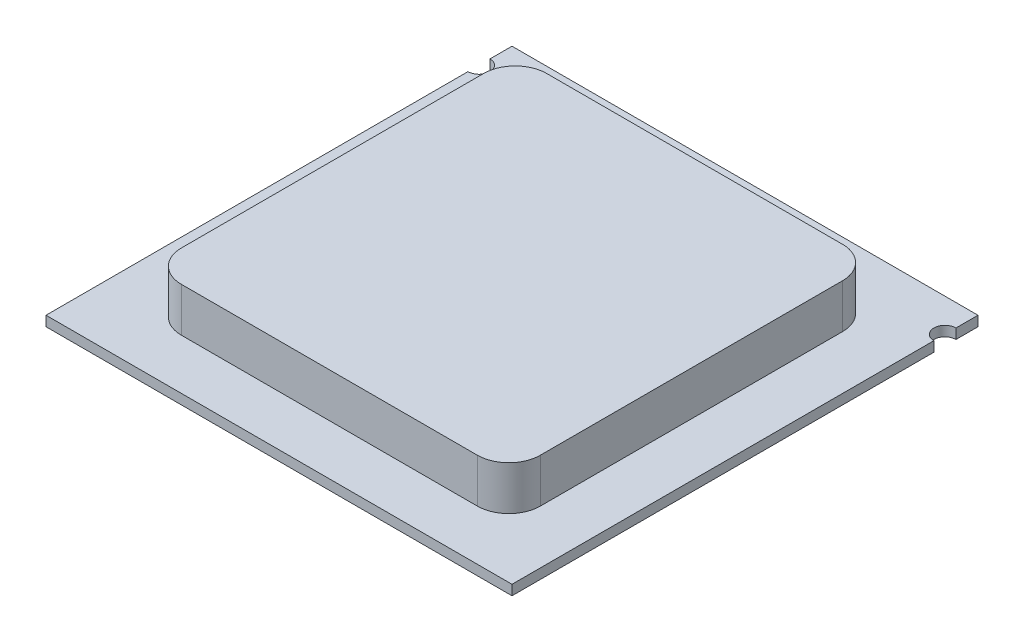
from build123d import *

# Parameters (mm, degrees)
BOSS_EXTRUDE1_DEPTH = 0.79375
BOSS_EXTRUDE2_DEPTH = 3.5


with BuildPart() as part:
    # Sketch1 → Boss-Extrude1 (new body)
    with BuildSketch(Plane(origin=(0, 0, 0), x_dir=(1, 0, 0), z_dir=(0, 1, 0))):
        with BuildLine():
            Line((-18.5, 18.5), (18.5, 18.5))
            Line((18.5, 18.5), (18.5, 16.75))
            ThreePointArc((18.5, 16.75), (17.625, 15.875), (18.5, 15))
            Line((18.5, 15), (18.5, -18.5))
            Line((18.5, -18.5), (-18.5, -18.5))
            Line((-18.5, -18.5), (-18.5, 15))
            ThreePointArc((-18.5, 15), (-17.625, 15.875), (-18.5, 16.75))
            Line((-18.5, 16.75), (-18.5, 18.5))
        make_face()
    extrude(amount=BOSS_EXTRUDE1_DEPTH)

    # Sketch2 → Boss-Extrude2 (add)
    with BuildSketch(Plane(origin=(0, 0.79375, 0), x_dir=(1, 0, 0), z_dir=(0, 1, 0))):
        with BuildLine():
            Line((-11.75, 14.5), (11.75, 14.5))
            ThreePointArc((11.75, 14.5), (13.517766953, 13.767766953), (14.25, 12))
            Line((14.25, 12), (14.25, -12))
            ThreePointArc((14.25, -12), (13.517766953, -13.767766953), (11.75, -14.5))
            Line((11.75, -14.5), (-11.75, -14.5))
            ThreePointArc((-11.75, -14.5), (-13.517766953, -13.767766953), (-14.25, -12))
            Line((-14.25, -12), (-14.25, 12))
            ThreePointArc((-14.25, 12), (-13.517766953, 13.767766953), (-11.75, 14.5))
        make_face()
    extrude(amount=BOSS_EXTRUDE2_DEPTH)


solid = part.part
